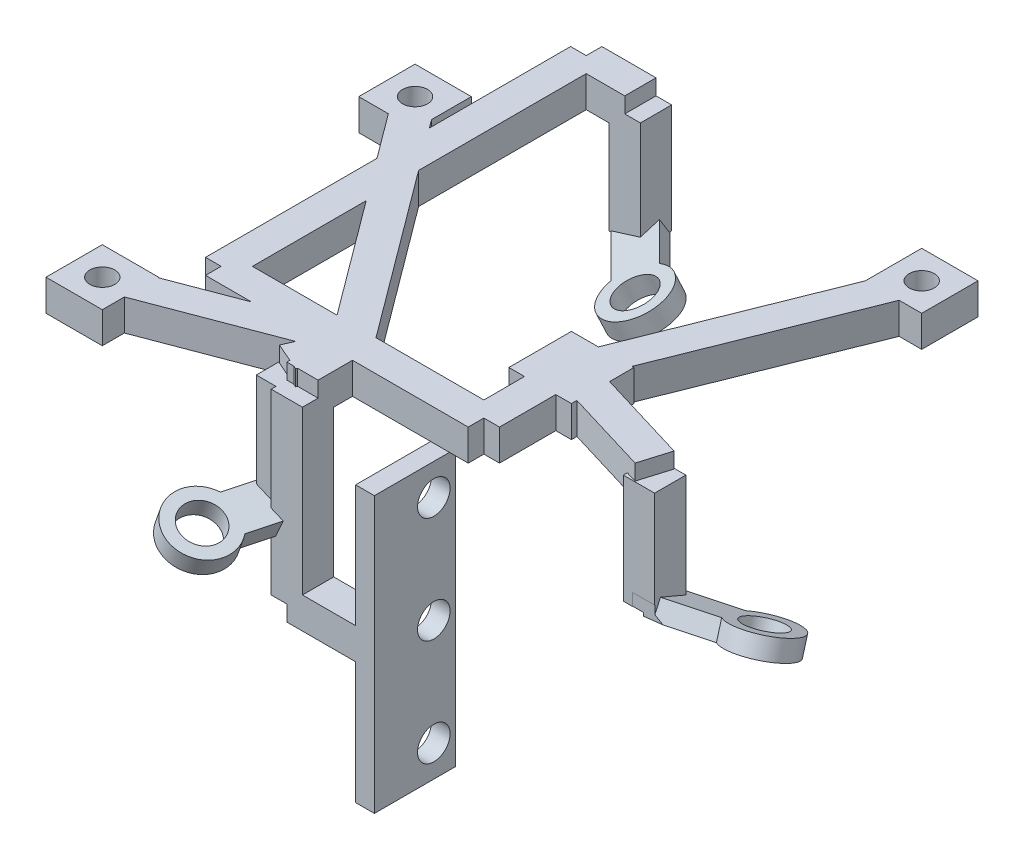
from build123d import *

# Parameters (mm, degrees)
CABLE_FAIRLEAD_SUPPORT_FRAME_FEATURE_PRO_W     = 10
CABLE_FAIRLEAD_SUPPORT_FRAME_FEATURE_PRO_H     = 5
CABLE_FAIRLEAD_SUPPORT_FRAME_FEATURE_DEPTH     = 10
FRAME_UPPER_TRUNK_SKETCH_W                     = 5
FRAME_UPPER_TRUNK_SKETCH_H                     = 5
FRAME_UPPER_TRUNK_FEATURE_DEPTH                = 14
FRAME_LEFT_TRUNK_SKETCH_W                      = 5
FRAME_LEFT_TRUNK_SKETCH_H                      = 5
FRAME_LEFT_TRUNK_FEATURE_DEPTH                 = 21
FIXED_FRAME_MOUNTING_WEB_1_SKETCH_W            = 5
FIXED_FRAME_MOUNTING_WEB_1_SKETCH_H            = 5
FIXED_FRAME_MOUNTING_WEB_1_FEATURE_DEPTH       = 48.600411521
PRISMATIC_M4_MOUNTING_PAD_1_PROFILE_W          = 9
PRISMATIC_M4_MOUNTING_PAD_1_PROFILE_H          = 5
PRISMATIC_M4_MOUNTING_PAD_1_DEPTH              = 9
NOMINAL_M4_MOUNTING_THREAD_1_PROFILE_R         = 2
NOMINAL_M4_MOUNTING_THREAD_1_DEPTH             = 9.1
FIXED_FRAME_MOUNTING_WEB_2_SKETCH_W            = 5
FIXED_FRAME_MOUNTING_WEB_2_SKETCH_H            = 5
FIXED_FRAME_MOUNTING_WEB_2_FEATURE_DEPTH       = 31.016124839
PRISMATIC_M4_MOUNTING_PAD_2_PROFILE_W          = 9
PRISMATIC_M4_MOUNTING_PAD_2_PROFILE_H          = 5
PRISMATIC_M4_MOUNTING_PAD_2_DEPTH              = 9
NOMINAL_M4_MOUNTING_THREAD_2_PROFILE_R         = 2
NOMINAL_M4_MOUNTING_THREAD_2_DEPTH             = 9.1
FIXED_FRAME_MOUNTING_WEB_3_SKETCH_W            = 5
FIXED_FRAME_MOUNTING_WEB_3_SKETCH_H            = 5
FIXED_FRAME_MOUNTING_WEB_3_FEATURE_DEPTH       = 43.081318457
PRISMATIC_M4_MOUNTING_PAD_3_PROFILE_W          = 9
PRISMATIC_M4_MOUNTING_PAD_3_PROFILE_H          = 5
PRISMATIC_M4_MOUNTING_PAD_3_DEPTH              = 9
NOMINAL_M4_MOUNTING_THREAD_3_PROFILE_R         = 2
NOMINAL_M4_MOUNTING_THREAD_3_DEPTH             = 9.1
OUTLET_SIDE_RISE_SKETCH_W                      = 5
OUTLET_SIDE_RISE_SKETCH_H                      = 5
OUTLET_SIDE_RISE_FEATURE_DEPTH                 = 8
OUTLET_LATERAL_RETURN_SKETCH_W                 = 5
OUTLET_LATERAL_RETURN_SKETCH_H                 = 5
OUTLET_LATERAL_RETURN_FEATURE_DEPTH            = 28.5
OUTLET_RAIL_BRIDGE_SKETCH_W                    = 5
OUTLET_RAIL_BRIDGE_SKETCH_H                    = 5
OUTLET_RAIL_BRIDGE_FEATURE_DEPTH               = 13
INTEGRAL_THREE_LANE_CABLE_OUTLET_CLA_2_W       = 3
INTEGRAL_THREE_LANE_CABLE_OUTLET_CLA_2_H       = 44
INTEGRAL_THREE_LANE_CABLE_OUTLET_CLAMP_R_DEPTH = 13
INLET_OUTRIGGER_WEB_1_SKETCH_W                 = 5
INLET_OUTRIGGER_WEB_1_SKETCH_H                 = 5
INLET_OUTRIGGER_WEB_1_FEATURE_DEPTH            = 19.897129262
INLET_VERTICAL_SUPPORT_1_SKETCH_W              = 5
INLET_VERTICAL_SUPPORT_1_SKETCH_H              = 5
INLET_VERTICAL_SUPPORT_1_FEATURE_DEPTH         = 17.458078567
INLET_COLLAR_RETAINING_WEB_1_FEATURE_DEPTH     = 14
INTEGRAL_CABLE_GUIDE_CLAMP_1_PROFILE_R         = 5
INTEGRAL_CABLE_GUIDE_CLAMP_1_DEPTH             = 2.99
FINAL_CABLE_INLET_CLAMP_THROUGH_BORE_1_P_R     = 3.1
FINAL_CABLE_INLET_CLAMP_THROUGH_BORE_1_DEPTH   = 7.2
INLET_OUTRIGGER_WEB_2_SKETCH_W                 = 5
INLET_OUTRIGGER_WEB_2_SKETCH_H                 = 5
INLET_OUTRIGGER_WEB_2_FEATURE_DEPTH            = 7.887446615
INLET_VERTICAL_SUPPORT_2_SKETCH_W              = 5
INLET_VERTICAL_SUPPORT_2_SKETCH_H              = 5
INLET_VERTICAL_SUPPORT_2_FEATURE_DEPTH         = 17.453498372
INLET_COLLAR_RETAINING_WEB_2_FEATURE_DEPTH     = 11.5
INTEGRAL_CABLE_GUIDE_CLAMP_2_PROFILE_R         = 5
INTEGRAL_CABLE_GUIDE_CLAMP_2_DEPTH             = 2.98
FINAL_CABLE_INLET_CLAMP_THROUGH_BORE_2_P_R     = 3.1
FINAL_CABLE_INLET_CLAMP_THROUGH_BORE_2_DEPTH   = 7.2
THIRD_INLET_CABLE_SWEEP_LEFT_BYPASS_SKET_W     = 5
THIRD_INLET_CABLE_SWEEP_LEFT_BYPASS_SKET_H     = 5
THIRD_INLET_CABLE_SWEEP_LEFT_BYPASS_FEAT_DEPTH = 21
THIRD_INLET_CABLE_SWEEP_LOWER_BYPASS_SKE_W     = 5
THIRD_INLET_CABLE_SWEEP_LOWER_BYPASS_SKE_H     = 5
THIRD_INLET_CABLE_SWEEP_LOWER_BYPASS_FEA_DEPTH = 58.366913444
THIRD_INLET_CABLE_SWEEP_RETURN_SKETCH_W        = 5
THIRD_INLET_CABLE_SWEEP_RETURN_SKETCH_H        = 5
THIRD_INLET_CABLE_SWEEP_RETURN_FEATURE_DEPTH   = 8.658958227
INLET_VERTICAL_SUPPORT_3_SKETCH_W              = 5
INLET_VERTICAL_SUPPORT_3_SKETCH_H              = 5
INLET_VERTICAL_SUPPORT_3_FEATURE_DEPTH         = 17.458078567
INLET_COLLAR_RETAINING_WEB_3_FEATURE_DEPTH     = 14
INTEGRAL_CABLE_GUIDE_CLAMP_3_PROFILE_R         = 5
INTEGRAL_CABLE_GUIDE_CLAMP_3_DEPTH             = 2.99
FINAL_CABLE_INLET_CLAMP_THROUGH_BORE_3_P_R     = 3.1
FINAL_CABLE_INLET_CLAMP_THROUGH_BORE_3_DEPTH   = 7.2
CABLE_OUTLET_CLAMP_BORE_1_PROFILE_R            = 2.6
CABLE_OUTLET_CLAMP_BORE_1_DEPTH                = 7.4
CABLE_OUTLET_CLAMP_BORE_2_PROFILE_R            = 2.6
CABLE_OUTLET_CLAMP_BORE_2_DEPTH                = 7.4
OUTLET_REAR_NUT_SEATING_CLEARANCE_2_PROF_R     = 4.75
OUTLET_REAR_NUT_SEATING_CLEARANCE_2_DEPTH      = 2.1
CABLE_OUTLET_CLAMP_BORE_3_PROFILE_R            = 2.6
CABLE_OUTLET_CLAMP_BORE_3_DEPTH                = 7.4
FIRST_INLET_WEB_COMB_CORNER_CLEARANCE_PR_W     = 5
FIRST_INLET_WEB_COMB_CORNER_CLEARANCE_PR_H     = 4
FIRST_INLET_WEB_COMB_CORNER_CLEARANCE_DEPTH    = 1.3
FIRST_WALL_MOUNT_OUTER_CORNER_RAIL_H_2_W       = 1.8
FIRST_WALL_MOUNT_OUTER_CORNER_RAIL_H_2_H       = 1.3
FIRST_WALL_MOUNT_OUTER_CORNER_RAIL_HEAD_DEPTH  = 5.1


with BuildPart() as part:
    # Cable Fairlead Support Frame Feature pro → Cable Fairlead Support Frame Feature (new body)
    with BuildSketch(Plane.XY.offset(-5)):
        with Locations((-50.291651246, -57.5)):
            Rectangle(CABLE_FAIRLEAD_SUPPORT_FRAME_FEATURE_PRO_W, CABLE_FAIRLEAD_SUPPORT_FRAME_FEATURE_PRO_H)
    extrude(amount=CABLE_FAIRLEAD_SUPPORT_FRAME_FEATURE_DEPTH)

    # Frame Upper Trunk Sketch → Frame Upper Trunk Feature (add)
    with BuildSketch(Plane.XY):
        with Locations((-50.291651246, -57.5)):
            Rectangle(FRAME_UPPER_TRUNK_SKETCH_W, FRAME_UPPER_TRUNK_SKETCH_H)
    extrude(amount=FRAME_UPPER_TRUNK_FEATURE_DEPTH)

    # Frame Left Trunk Sketch → Frame Left Trunk Feature (add)
    with BuildSketch(Plane.ZY.offset(50.291651246)):
        with Locations((14, -57.5)):
            Rectangle(FRAME_LEFT_TRUNK_SKETCH_W, FRAME_LEFT_TRUNK_SKETCH_H)
    extrude(amount=FRAME_LEFT_TRUNK_FEATURE_DEPTH)

    # Fixed Frame Mounting Web 1 Sketch → Fixed Frame Mounting Web 1 Feature (add)
    with BuildSketch(Plane(origin=(-18.680050253, 0, -25.121446892), x_dir=(-0.8024623409461341, 0, 0.59670276634456), z_dir=(-0.59670276634456, 0, -0.8024623409461341))):
        with Locations((65.562704078, -57.5)):
            Rectangle(FIXED_FRAME_MOUNTING_WEB_1_SKETCH_W, FIXED_FRAME_MOUNTING_WEB_1_SKETCH_H)
    extrude(amount=FIXED_FRAME_MOUNTING_WEB_1_FEATURE_DEPTH)

    # Prismatic M4 Mounting Pad 1 profile → Prismatic M4 Mounting Pad 1 (add)
    with BuildSketch(Plane.XY.offset(-29.5)):
        with Locations((-100.291651246, -57.5)):
            Rectangle(PRISMATIC_M4_MOUNTING_PAD_1_PROFILE_W, PRISMATIC_M4_MOUNTING_PAD_1_PROFILE_H)
    extrude(amount=PRISMATIC_M4_MOUNTING_PAD_1_DEPTH)

    # Nominal M4 Mounting Thread 1 profile → Nominal M4 Mounting Thread 1 (cut)
    with BuildSketch(Plane(origin=(0, -51, 0), x_dir=(-1, 0, 0), z_dir=(0, -1, 0))):
        with Locations(Location((100.291651246, 25, 0), (0, 0, 270))):
            Circle(NOMINAL_M4_MOUNTING_THREAD_1_PROFILE_R)
    extrude(amount=NOMINAL_M4_MOUNTING_THREAD_1_DEPTH, mode=Mode.SUBTRACT)

    # Fixed Frame Mounting Web 2 Sketch → Fixed Frame Mounting Web 2 Feature (add)
    with BuildSketch(Plane(origin=(-66.967025673, 0, 25.4012856), x_dir=(0.35465423412053826, 0, 0.9349975263177837), z_dir=(-0.9349975263177837, 0, 0.35465423412053826))):
        with Locations((-12.193920603, -57.5)):
            Rectangle(FIXED_FRAME_MOUNTING_WEB_2_SKETCH_W, FIXED_FRAME_MOUNTING_WEB_2_SKETCH_H)
    extrude(amount=FIXED_FRAME_MOUNTING_WEB_2_FEATURE_DEPTH)

    # Prismatic M4 Mounting Pad 2 profile → Prismatic M4 Mounting Pad 2 (add)
    with BuildSketch(Plane.XY.offset(20.5)):
        with Locations((-100.291651246, -57.5)):
            Rectangle(PRISMATIC_M4_MOUNTING_PAD_2_PROFILE_W, PRISMATIC_M4_MOUNTING_PAD_2_PROFILE_H)
    extrude(amount=PRISMATIC_M4_MOUNTING_PAD_2_DEPTH)

    # Nominal M4 Mounting Thread 2 profile → Nominal M4 Mounting Thread 2 (cut)
    with BuildSketch(Plane(origin=(0, -51, 0), x_dir=(-1, 0, 0), z_dir=(0, -1, 0))):
        with Locations(Location((100.291651246, -25, 0), (0, 0, 270))):
            Circle(NOMINAL_M4_MOUNTING_THREAD_2_PROFILE_R)
    extrude(amount=NOMINAL_M4_MOUNTING_THREAD_2_DEPTH, mode=Mode.SUBTRACT)

    # Fixed Frame Mounting Web 3 Sketch → Fixed Frame Mounting Web 3 Feature (add)
    with BuildSketch(Plane(origin=(-6.936779482, 0, 17.341948706), x_dir=(-0.9284766908852594, 0, -0.3713906763541037), z_dir=(0.37139067635410367, 0, -0.9284766908852593))):
        with Locations((46.694625928, -57.5)):
            Rectangle(FIXED_FRAME_MOUNTING_WEB_3_SKETCH_W, FIXED_FRAME_MOUNTING_WEB_3_SKETCH_H)
    extrude(amount=FIXED_FRAME_MOUNTING_WEB_3_FEATURE_DEPTH)

    # Prismatic M4 Mounting Pad 3 profile → Prismatic M4 Mounting Pad 3 (add)
    with BuildSketch(Plane.XY.offset(-44.5)):
        with Locations((-34.291651246, -57.5)):
            Rectangle(PRISMATIC_M4_MOUNTING_PAD_3_PROFILE_W, PRISMATIC_M4_MOUNTING_PAD_3_PROFILE_H)
    extrude(amount=PRISMATIC_M4_MOUNTING_PAD_3_DEPTH)

    # Nominal M4 Mounting Thread 3 profile → Nominal M4 Mounting Thread 3 (cut)
    with BuildSketch(Plane(origin=(0, -51, 0), x_dir=(-1, 0, 0), z_dir=(0, -1, 0))):
        with Locations(Location((34.291651246, 40, 0), (0, 0, 270))):
            Circle(NOMINAL_M4_MOUNTING_THREAD_3_PROFILE_R)
    extrude(amount=NOMINAL_M4_MOUNTING_THREAD_3_DEPTH, mode=Mode.SUBTRACT)

    # Outlet Side Rise Sketch → Outlet Side Rise Feature (add)
    with BuildSketch(Plane.XY.offset(14)):
        with Locations((-71.291651246, -57.5)):
            Rectangle(OUTLET_SIDE_RISE_SKETCH_W, OUTLET_SIDE_RISE_SKETCH_H)
    extrude(amount=OUTLET_SIDE_RISE_FEATURE_DEPTH)

    # Outlet Lateral Return Sketch → Outlet Lateral Return Feature (add)
    with BuildSketch(Plane(origin=(0, -57.5, 0), x_dir=(1, 0, 0), z_dir=(0, 1, 0))):
        with Locations((-71.291651246, -22)):
            Rectangle(OUTLET_LATERAL_RETURN_SKETCH_W, OUTLET_LATERAL_RETURN_SKETCH_H)
    extrude(amount=OUTLET_LATERAL_RETURN_FEATURE_DEPTH)

    # Outlet Rail Bridge Sketch → Outlet Rail Bridge Feature (add)
    with BuildSketch(Plane(origin=(-71.291651246, 0, 0), x_dir=(0, 0, -1), z_dir=(1, 0, 0))):
        with Locations((-22, -29)):
            Rectangle(OUTLET_RAIL_BRIDGE_SKETCH_W, OUTLET_RAIL_BRIDGE_SKETCH_H)
    extrude(amount=OUTLET_RAIL_BRIDGE_FEATURE_DEPTH)

    # Integral Three Lane Cable Outlet Cla 2 → Integral Three Lane Cable Outlet Clamp R (add)
    with BuildSketch(Plane.XY.offset(11.5)):
        with Locations((-58.791651246, -29)):
            Rectangle(INTEGRAL_THREE_LANE_CABLE_OUTLET_CLA_2_W, INTEGRAL_THREE_LANE_CABLE_OUTLET_CLA_2_H)
    extrude(amount=INTEGRAL_THREE_LANE_CABLE_OUTLET_CLAMP_R_DEPTH)

    # Inlet Outrigger Web 1 Sketch → Inlet Outrigger Web 1 Feature (add)
    with BuildSketch(Plane(origin=(-46.088198712, 0, -13.918676505), x_dir=(0.28910468276520457, 0, -0.9572974889778153), z_dir=(0.9572974889778154, 0, 0.28910468276520457))):
        with Locations((-14.539551879, -57.5)):
            Rectangle(INLET_OUTRIGGER_WEB_1_SKETCH_W, INLET_OUTRIGGER_WEB_1_SKETCH_H)
    extrude(amount=INLET_OUTRIGGER_WEB_1_FEATURE_DEPTH)

    # Inlet Vertical Support 1 Sketch → Inlet Vertical Support 1 Feature (add)
    with BuildSketch(Plane(origin=(0, -57.5, 0), x_dir=(1, 0, 0), z_dir=(0, 1, 0))):
        with Locations((-31.244179366, -5.752353243)):
            Rectangle(INLET_VERTICAL_SUPPORT_1_SKETCH_W, INLET_VERTICAL_SUPPORT_1_SKETCH_H)
    extrude(amount=INLET_VERTICAL_SUPPORT_1_FEATURE_DEPTH)

    # Inlet Collar Retaining Web 1 Sketch → Inlet Collar Retaining Web 1 Feature (add)
    with BuildSketch(Plane(origin=(-30.589304519, 0, 8.196379443), x_dir=(-0.2588190451025209, 0, -0.9659258262890683), z_dir=(0.9659258262890682, 0, -0.25881904510252085))):
        Polygon((-0.817503267, -39.875711022), (0.381753684, -42.614667532), (5.877987484, -40.208131845), (4.678730534, -37.469175335), align=None)
    extrude(amount=INLET_COLLAR_RETAINING_WEB_1_FEATURE_DEPTH)

    # Integral Cable Guide Clamp 1 profile → Integral Cable Guide Clamp 1 (add)
    with BuildSketch(Plane(origin=(-3.757886141, -33.160439592, -14.024622008), x_dir=(-0.9945971940532637, 0.09561015120206427, 0.040436624098617396), z_dir=(-0.10380954475082953, -0.916038966713815, -0.38742249532069234))):
        with Locations((13.883144322, -17.558147475)):
            Circle(INTEGRAL_CABLE_GUIDE_CLAMP_1_PROFILE_R)
    extrude(amount=INTEGRAL_CABLE_GUIDE_CLAMP_1_DEPTH)

    # Final Cable Inlet Clamp Through Bore 1 p → Final Cable Inlet Clamp Through Bore 1 (cut)
    with BuildSketch(Plane(origin=(-3.746467091, -33.059675306, -13.982005534), x_dir=(-0.9945971940532637, 0.09561015120206481, 0.040436624098617716), z_dir=(-0.10380954475083015, -0.9160389667138147, -0.38742249532069273))):
        with Locations(Location((13.883144322, -17.558147475, 0), (0, 0, 270))):
            Circle(FINAL_CABLE_INLET_CLAMP_THROUGH_BORE_1_P_R)
    extrude(amount=FINAL_CABLE_INLET_CLAMP_THROUGH_BORE_1_DEPTH, mode=Mode.SUBTRACT)

    # Inlet Outrigger Web 2 Sketch → Inlet Outrigger Web 2 Feature (add)
    with BuildSketch(Plane(origin=(-16.501146425, 0, 37.872417183), x_dir=(0.9167610626613684, 0, 0.39943604492834506), z_dir=(-0.39943604492834506, 0, 0.9167610626613684))):
        with Locations((-59.765305326, -57.5)):
            Rectangle(INLET_OUTRIGGER_WEB_2_SKETCH_W, INLET_OUTRIGGER_WEB_2_SKETCH_H)
    extrude(amount=INLET_OUTRIGGER_WEB_2_FEATURE_DEPTH)

    # Inlet Vertical Support 2 Sketch → Inlet Vertical Support 2 Feature (add)
    with BuildSketch(Plane(origin=(0, -57.5, 0), x_dir=(1, 0, 0), z_dir=(0, 1, 0))):
        with Locations((-74.442181727, -21.230903941)):
            Rectangle(INLET_VERTICAL_SUPPORT_2_SKETCH_W, INLET_VERTICAL_SUPPORT_2_SKETCH_H)
    extrude(amount=INLET_VERTICAL_SUPPORT_2_FEATURE_DEPTH)

    # Inlet Collar Retaining Web 2 Sketch → Inlet Collar Retaining Web 2 Feature (add)
    with BuildSketch(Plane(origin=(-10.294406604, 0, 38.419248481), x_dir=(0.9659258262890684, 0, 0.2588190451025205), z_dir=(-0.2588190451025205, 0, 0.9659258262890684))):
        Polygon((-69.756403539, -39.884871411), (-68.561157482, -42.614667532), (-63.064923681, -40.208131845), (-64.260169739, -37.478335724), align=None)
    extrude(amount=INLET_COLLAR_RETAINING_WEB_2_FEATURE_DEPTH)

    # Integral Cable Guide Clamp 2 profile → Integral Cable Guide Clamp 2 (add)
    with BuildSketch(Plane(origin=(3.315387624, -7.839049849, 0.888355436), x_dir=(-0.9219022779663189, -0.3849584828862101, 0.04362518005074423), z_dir=(0.387422495320693, -0.9160389667138146, 0.10380954475083053))):
        with Locations((88.199421816, -27.623992603)):
            Circle(INTEGRAL_CABLE_GUIDE_CLAMP_2_PROFILE_R)
    extrude(amount=INTEGRAL_CABLE_GUIDE_CLAMP_2_DEPTH)

    # Final Cable Inlet Clamp Through Bore 2 p → Final Cable Inlet Clamp Through Bore 2 (cut)
    with BuildSketch(Plane(origin=(3.268896925, -7.729125173, 0.875898291), x_dir=(-0.921902277966319, -0.38495848288620965, 0.04362518005074392), z_dir=(0.3874224953206925, -0.9160389667138148, 0.10380954475082999))):
        with Locations(Location((88.199421816, -27.623992603, 0), (0, 0, 2.513923103))):
            Circle(FINAL_CABLE_INLET_CLAMP_THROUGH_BORE_2_P_R)
    extrude(amount=FINAL_CABLE_INLET_CLAMP_THROUGH_BORE_2_DEPTH, mode=Mode.SUBTRACT)

    # Third Inlet Cable Sweep Left Bypass Sket → Third Inlet Cable Sweep Left Bypass Feature (add)
    with BuildSketch(Plane.ZY.offset(71.291651246)):
        with Locations((14, -57.5)):
            Rectangle(THIRD_INLET_CABLE_SWEEP_LEFT_BYPASS_SKET_W, THIRD_INLET_CABLE_SWEEP_LEFT_BYPASS_SKET_H)
    extrude(amount=THIRD_INLET_CABLE_SWEEP_LEFT_BYPASS_FEAT_DEPTH)

    # Third Inlet Cable Sweep Lower Bypass Ske → Third Inlet Cable Sweep Lower Bypass Feature (add)
    with BuildSketch(Plane(origin=(0, 0, 14), x_dir=(-1, 0, 0), z_dir=(0, 0, -1))):
        with Locations((92.291651246, -57.5)):
            Rectangle(THIRD_INLET_CABLE_SWEEP_LOWER_BYPASS_SKE_W, THIRD_INLET_CABLE_SWEEP_LOWER_BYPASS_SKE_H)
    extrude(amount=THIRD_INLET_CABLE_SWEEP_LOWER_BYPASS_FEA_DEPTH)

    # Third Inlet Cable Sweep Return Sketch → Third Inlet Cable Sweep Return Feature (add)
    with BuildSketch(Plane(origin=(-92.291651246, 0, 0), x_dir=(0, 0, -1), z_dir=(1, 0, 0))):
        with Locations((44.366913444, -57.5)):
            Rectangle(THIRD_INLET_CABLE_SWEEP_RETURN_SKETCH_W, THIRD_INLET_CABLE_SWEEP_RETURN_SKETCH_H)
    extrude(amount=THIRD_INLET_CABLE_SWEEP_RETURN_FEATURE_DEPTH)

    # Inlet Vertical Support 3 Sketch → Inlet Vertical Support 3 Feature (add)
    with BuildSketch(Plane(origin=(0, -57.5, 0), x_dir=(1, 0, 0), z_dir=(0, 1, 0))):
        with Locations((-83.632693019, 44.366913444)):
            Rectangle(INLET_VERTICAL_SUPPORT_3_SKETCH_W, INLET_VERTICAL_SUPPORT_3_SKETCH_H)
    extrude(amount=INLET_VERTICAL_SUPPORT_3_FEATURE_DEPTH)

    # Inlet Collar Retaining Web 3 Sketch → Inlet Collar Retaining Web 3 Feature (add)
    with BuildSketch(Plane(origin=(-63.999803232, 0, -63.999803232), x_dir=(0.7071067811865468, -1.0547118733938963e-15, -0.7071067811865483), z_dir=(0.7071067811865483, -1.0547118733939003e-15, 0.7071067811865468))):
        Polygon((-29.913587431, -37.469175335), (-31.112844382, -40.208131845), (-25.616610582, -42.614667532), (-24.417353631, -39.875711022), align=None)
    extrude(amount=INLET_COLLAR_RETAINING_WEB_3_FEATURE_DEPTH)

    # Integral Cable Guide Clamp 3 profile → Integral Cable Guide Clamp 3 (add)
    with BuildSketch(Plane(origin=(-13.137304667, -42.432064433, 13.137304667), x_dir=(-0.9589388376059532, 0.27092501001970076, -0.0838805381287477), z_dir=(-0.2836129505698625, -0.9160389667138149, 0.2836129505698623))):
        with Locations((62.748414909, 44.768137691)):
            Circle(INTEGRAL_CABLE_GUIDE_CLAMP_3_PROFILE_R)
    extrude(amount=INTEGRAL_CABLE_GUIDE_CLAMP_3_DEPTH)

    # Final Cable Inlet Clamp Through Bore 3 p → Final Cable Inlet Clamp Through Bore 3 (cut)
    with BuildSketch(Plane(origin=(-13.106107242, -42.331300147, 13.106107242), x_dir=(-0.9589388376059532, 0.27092501001970104, -0.08388053812874786), z_dir=(-0.2836129505698628, -0.9160389667138148, 0.2836129505698625))):
        with Locations(Location((62.748414909, 44.768137691, 0), (0, 0, 354.981795923))):
            Circle(FINAL_CABLE_INLET_CLAMP_THROUGH_BORE_3_P_R)
    extrude(amount=FINAL_CABLE_INLET_CLAMP_THROUGH_BORE_3_DEPTH, mode=Mode.SUBTRACT)

    # Cable Outlet Clamp Bore 1 profile → Cable Outlet Clamp Bore 1 (cut)
    with BuildSketch(Plane(origin=(-62.391651246, 0, 0), x_dir=(0, 0, -1), z_dir=(1, 0, 0))):
        with Locations(Location((-15, -12, 0), (0, 0, 180))):
            Circle(CABLE_OUTLET_CLAMP_BORE_1_PROFILE_R)
    extrude(amount=CABLE_OUTLET_CLAMP_BORE_1_DEPTH, mode=Mode.SUBTRACT)

    # Cable Outlet Clamp Bore 2 profile → Cable Outlet Clamp Bore 2 (cut)
    with BuildSketch(Plane(origin=(-62.391651246, 0, 0), x_dir=(0, 0, -1), z_dir=(1, 0, 0))):
        with Locations(Location((-15, -29, 0), (0, 0, 180))):
            Circle(CABLE_OUTLET_CLAMP_BORE_2_PROFILE_R)
    extrude(amount=CABLE_OUTLET_CLAMP_BORE_2_DEPTH, mode=Mode.SUBTRACT)

    # Outlet Rear Nut Seating Clearance 2 prof → Outlet Rear Nut Seating Clearance 2 (cut)
    with BuildSketch(Plane(origin=(-62.391651246, 0, 0), x_dir=(0, 0, -1), z_dir=(1, 0, 0))):
        with Locations((-15, -29)):
            Circle(OUTLET_REAR_NUT_SEATING_CLEARANCE_2_PROF_R)
    extrude(amount=OUTLET_REAR_NUT_SEATING_CLEARANCE_2_DEPTH, mode=Mode.SUBTRACT)

    # Cable Outlet Clamp Bore 3 profile → Cable Outlet Clamp Bore 3 (cut)
    with BuildSketch(Plane(origin=(-62.391651246, 0, 0), x_dir=(0, 0, -1), z_dir=(1, 0, 0))):
        with Locations(Location((-15, -46, 0), (0, 0, 180))):
            Circle(CABLE_OUTLET_CLAMP_BORE_3_PROFILE_R)
    extrude(amount=CABLE_OUTLET_CLAMP_BORE_3_DEPTH, mode=Mode.SUBTRACT)

    # First Inlet Web Comb Corner Clearance pr → First Inlet Web Comb Corner Clearance (cut)
    with BuildSketch(Plane.XY.offset(8.2)):
        with Locations((-29.791651246, -40)):
            Rectangle(FIRST_INLET_WEB_COMB_CORNER_CLEARANCE_PR_W, FIRST_INLET_WEB_COMB_CORNER_CLEARANCE_PR_H)
    extrude(amount=FIRST_INLET_WEB_COMB_CORNER_CLEARANCE_DEPTH, mode=Mode.SUBTRACT)

    # First Wall Mount Outer Corner Rail H 2 → First Wall Mount Outer Corner Rail Head (cut)
    with BuildSketch(Plane.XY.offset(-29.6)):
        with Locations((-103.991651246, -55.55)):
            Rectangle(FIRST_WALL_MOUNT_OUTER_CORNER_RAIL_H_2_W, FIRST_WALL_MOUNT_OUTER_CORNER_RAIL_H_2_H)
    extrude(amount=FIRST_WALL_MOUNT_OUTER_CORNER_RAIL_HEAD_DEPTH, mode=Mode.SUBTRACT)


with BuildPart() as body_2:
    # Mirror1: mirrored copy
    add(part.part.mirror(Plane(origin=(0, 0, 0), x_dir=(0, 0, 1), z_dir=(0, -1, 0))))


solid = body_2.part
